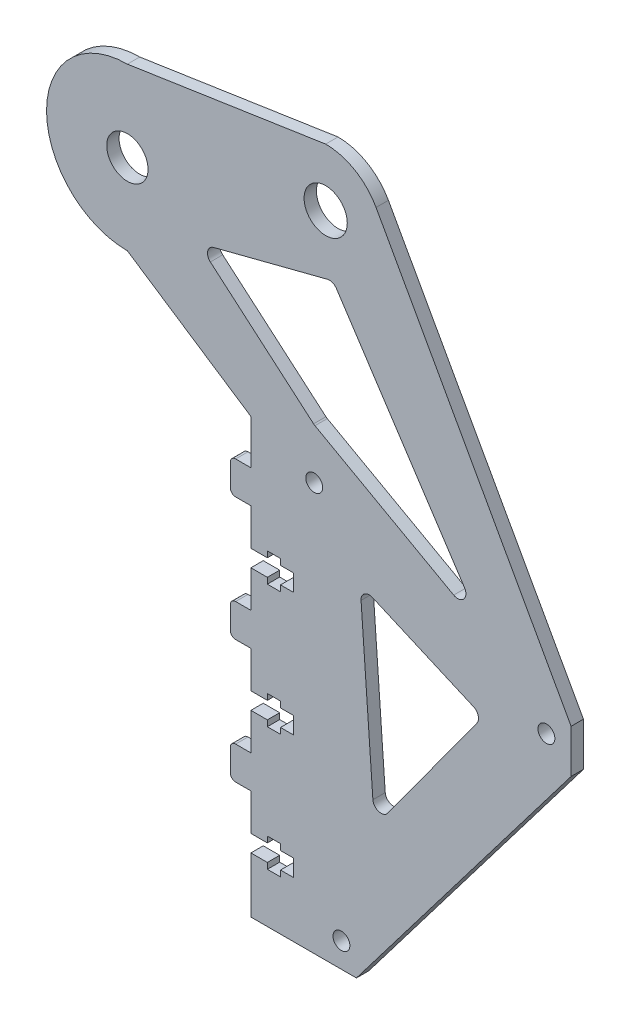
from build123d import *

# Parameters (mm, degrees)
SKETCH_1_R      = 5.0225
SKETCH_1_R_2    = 2.05
SKETCH_1_R_3    = 5.25
EXTRUDE_1_DEPTH = 3
FILLET_1_R      = 2
FILLET_2_R      = 1.3


with BuildPart() as part:
    # 草图1 → 凸台-拉伸1 (new body)
    with BuildSketch(Plane.XY):
        with BuildLine():
            Line((298.545628784, -83.894391363), (298.545628784, -92.841778663))
            Line((298.545628784, -92.841778663), (302.545628784, -92.841778663))
            Line((302.545628784, -92.841778663), (302.545628784, -91.391778663))
            Line((302.545628784, -91.391778663), (305.745628784, -91.391778663))
            Line((305.745628784, -91.391778663), (305.745628784, -92.841778663))
            Line((305.745628784, -92.841778663), (308.945628784, -92.841778663))
            Line((308.945628784, -92.841778663), (308.945628784, -96.941778663))
            Line((308.945628784, -96.941778663), (305.745628784, -96.941778663))
            Line((305.745628784, -96.941778663), (305.745628784, -98.391778663))
            Line((305.745628784, -98.391778663), (302.545628784, -98.391778663))
            Line((302.545628784, -98.391778663), (302.545628784, -96.941778663))
            Line((302.545628784, -96.941778663), (298.545628784, -96.941778663))
            Line((298.545628784, -96.941778663), (298.545628784, -105.894391358))
            Line((298.545628784, -105.894391358), (293.545628784, -105.894391358))
            Line((293.545628784, -105.894391358), (293.545628784, -113.894391358))
            Line((293.545628784, -113.894391358), (298.545628784, -113.894391358))
            Line((298.545628784, -113.894391358), (298.545628784, -122.847004054))
            Line((298.545628784, -122.847004054), (302.545628784, -122.847004054))
            Line((302.545628784, -122.847004054), (302.545628784, -121.397004054))
            Line((302.545628784, -121.397004054), (305.745628784, -121.397004054))
            Line((305.745628784, -121.397004054), (305.745628784, -122.847004054))
            Line((305.745628784, -122.847004054), (308.945628784, -122.847004054))
            Line((308.945628784, -122.847004054), (308.945628784, -126.947004054))
            Line((308.945628784, -126.947004054), (305.745628784, -126.947004054))
            Line((305.745628784, -126.947004054), (305.745628784, -128.397004054))
            Line((305.745628784, -128.397004054), (302.545628784, -128.397004054))
            Line((302.545628784, -128.397004054), (302.545628784, -126.947004054))
            Line((302.545628784, -126.947004054), (298.545628784, -126.947004054))
            Line((298.545628784, -126.947004054), (298.545628784, -140.447004054))
            Line((298.545628784, -140.447004054), (324.188862368, -140.447004054))
            Line((324.188862368, -140.447004054), (376.358604426, -71.946984141))
            Line((376.358604426, -71.946984141), (376.358604426, -61.391778668))
            Line((376.358604426, -61.391778668), (328.961754808, 24.094724856))
            ThreePointArc((328.961754808, 24.094724856), (323.822689813, 29.369350164), (316.717741365, 31.306195206))
            Line((316.717741365, 31.306195206), (268.536959304, 24.041593685))
            ThreePointArc((268.536959304, 24.041593685), (248.891566772, 4.396186988), (268.536987634, -15.249191379))
            Line((268.536987634, -15.249191379), (298.545628784, -35.096984141))
            Line((298.545628784, -35.096984141), (298.545628784, -45.889165972))
            Line((298.545628784, -45.889165972), (293.545628784, -45.889165972))
            Line((293.545628784, -45.889165972), (293.545628784, -53.889165972))
            Line((293.545628784, -53.889165972), (298.545628784, -53.889165972))
            Line((298.545628784, -53.889165972), (298.545628784, -62.841778668))
            Line((298.545628784, -62.841778668), (302.545628784, -62.841778668))
            Line((302.545628784, -62.841778668), (302.545628784, -61.391778668))
            Line((302.545628784, -61.391778668), (305.745628784, -61.391778668))
            Line((305.745628784, -61.391778668), (305.745628784, -62.841778668))
            Line((305.745628784, -62.841778668), (308.945628784, -62.841778668))
            Line((308.945628784, -62.841778668), (308.945628784, -66.941778668))
            Line((308.945628784, -66.941778668), (305.745628784, -66.941778668))
            Line((305.745628784, -66.941778668), (305.745628784, -68.391778668))
            Line((305.745628784, -68.391778668), (302.545628784, -68.391778668))
            Line((302.545628784, -68.391778668), (302.545628784, -66.941778668))
            Line((302.545628784, -66.941778668), (298.545628784, -66.941778668))
            Line((298.545628784, -66.941778668), (298.545628784, -75.894391363))
            Line((298.545628784, -75.894391363), (293.545628784, -75.894391363))
            Line((293.545628784, -75.894391363), (293.545628784, -83.894391363))
            Line((293.545628784, -83.894391363), (298.545628784, -83.894391363))
        make_face()
        with Locations((268.536959304, 4.396201153)):
            Circle(SKETCH_1_R, mode=Mode.SUBTRACT)
        with Locations((320.545628784, -134.447004054)):
            Circle(SKETCH_1_R_2, mode=Mode.SUBTRACT)
        with Locations((370.358604426, -65.946984141)):
            Circle(SKETCH_1_R_2, mode=Mode.SUBTRACT)
        with Locations((313.936987634, -41.346984141)):
            Circle(SKETCH_1_R_2, mode=Mode.SUBTRACT)
        with Locations((316.717741365, 17.306195206)):
            Circle(SKETCH_1_R_3, mode=Mode.SUBTRACT)
        Polygon((354.947285032, -70.136765586), (328.579617375, -106.396108383), (325.08144343, -57.115165973), align=None, mode=Mode.SUBTRACT)
        Polygon((318.527528456, 3.423664072), (285.781281912, -5.015216674), (313.936947803, -29.165661305), (354.9472452, -52.015830841), align=None, mode=Mode.SUBTRACT)
    extrude(amount=EXTRUDE_1_DEPTH)

    # 圆角1
    fillet_1_edges = [part.edges().sort_by_distance(p)[0] for p in [
        (354.9472452, -52.015830841, 1.5),
        (318.527528456, 3.423664072, 1.5),
        (285.781281912, -5.015216674, 1.5),
        (313.936947803, -29.165661305, 1.5),
        (354.947285032, -70.136765586, 1.5),
        (325.08144343, -57.115165973, 1.5),
        (328.579617375, -106.396108383, 1.5),
    ]]
    fillet(fillet_1_edges, radius=FILLET_1_R)

    # 圆角2
    fillet_2_edges = [part.edges().sort_by_distance(p)[0] for p in [
        (293.545628784, -83.894391363, 1.5),
        (293.545628784, -75.894391363, 1.5),
        (293.545628784, -53.889165972, 1.5),
        (293.545628784, -45.889165972, 1.5),
        (293.545628784, -113.894391358, 1.5),
        (293.545628784, -105.894391358, 1.5),
    ]]
    fillet(fillet_2_edges, radius=FILLET_2_R)


solid = part.part
